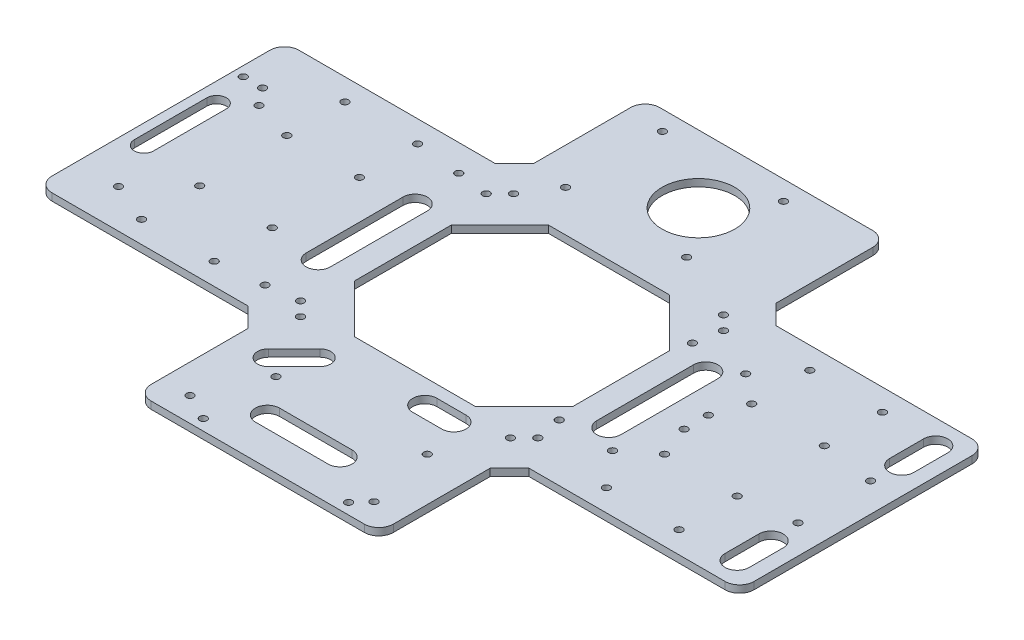
from build123d import *

# Parameters (mm, degrees)
EXTRUDE_1_DEPTH      = 3
SKETCH_2_R           = 1.5
CUT_EXTRUDE_1_DEPTH  = 3
SKETCH_3_R           = 15
SKETCH_3_R_2         = 1.5
CUT_EXTRUDE_2_DEPTH  = 10
SKETCH_4_W           = 90
SKETCH_4_H           = 80
CUT_EXTRUDE_3_DEPTH  = 3
FILLET_3_R           = 6
CHAMFER_1_SIZE       = 8
SKETCH_7_R           = 1.5
CUT_EXTRUDE_6_DEPTH  = 10
CHAMFER_2_SIZE       = 20
SKETCH_8_R           = 1.5
CUT_EXTRUDE_7_DEPTH  = 10
SKETCH_9_R           = 1.5
CUT_EXTRUDE_8_DEPTH  = 10
SKETCH_10_R          = 1.5
CUT_EXTRUDE_9_DEPTH  = 10
CUT_EXTRUDE_10_DEPTH = 10


with BuildPart() as part:
    # 草图1 → 凸台-拉伸1 (new body)
    with BuildSketch(Plane(origin=(0, 0, 0), x_dir=(1, 0, 0), z_dir=(0, 1, 0))):
        Polygon((-50, -51), (-50, -105), (50, -105), (50, -51), (145, -51), (145, 51), (50, 51), (50, 105), (-50, 105), (-50, 51), (-145, 51), (-145, -51), align=None)
    extrude(amount=EXTRUDE_1_DEPTH)

    # 草图2 → 切除-拉伸1 (cut)
    with BuildSketch(Plane(origin=(0, 3, 0), x_dir=(1, 0, 0), z_dir=(0, 1, 0))):
        with Locations(Location((111, 42, 0), (0, 0, 270))):
            Circle(SKETCH_2_R)
        with Locations(Location((81, 42, 0), (0, 0, 270))):
            Circle(SKETCH_2_R)
        with Locations(Location((81, 18, 0), (0, 0, 270))):
            Circle(SKETCH_2_R)
        with Locations(Location((111, 18, 0), (0, 0, 270))):
            Circle(SKETCH_2_R)
        with Locations(Location((111, -18, 0), (0, 0, 90))):
            Circle(SKETCH_2_R)
        with Locations(Location((111, -42, 0), (0, 0, 90))):
            Circle(SKETCH_2_R)
        with Locations(Location((81, -18, 0), (0, 0, 90))):
            Circle(SKETCH_2_R)
        with Locations(Location((81, -42, 0), (0, 0, 90))):
            Circle(SKETCH_2_R)
        with Locations(Location((-81, -42, 0), (0, 0, 270))):
            Circle(SKETCH_2_R)
        with Locations(Location((-81, -18, 0), (0, 0, 270))):
            Circle(SKETCH_2_R)
        with Locations(Location((-111, -42, 0), (0, 0, 270))):
            Circle(SKETCH_2_R)
        with Locations(Location((-111, -18, 0), (0, 0, 270))):
            Circle(SKETCH_2_R)
        with Locations(Location((-111, 18, 0), (0, 0, 90))):
            Circle(SKETCH_2_R)
        with Locations(Location((-81, 18, 0), (0, 0, 90))):
            Circle(SKETCH_2_R)
        with Locations(Location((-81, 42, 0), (0, 0, 90))):
            Circle(SKETCH_2_R)
        with Locations(Location((-111, 42, 0), (0, 0, 90))):
            Circle(SKETCH_2_R)
    extrude(amount=-CUT_EXTRUDE_1_DEPTH, mode=Mode.SUBTRACT)

    # 草图3 → 切除-拉伸2 (cut)
    with BuildSketch(Plane(origin=(0, 3, 0), x_dir=(1, 0, 0), z_dir=(0, 1, 0))):
        with Locations(Location((0, 77, 0), (0, 0, 270))):
            Circle(SKETCH_3_R)
        with Locations(Location((15.11, 97, 0), (0, 0, 270))):
            Circle(SKETCH_3_R_2)
        with Locations(Location((15.11, 57, 0), (0, 0, 270))):
            Circle(SKETCH_3_R_2)
        with Locations(Location((-34.89, 57, 0), (0, 0, 270))):
            Circle(SKETCH_3_R_2)
        with Locations(Location((-34.89, 97, 0), (0, 0, 270))):
            Circle(SKETCH_3_R_2)
        with Locations(Location((-27, -70.5, 0), (0, 0, 270))):
            Circle(SKETCH_3_R_2)
        with Locations(Location((32, -67, 0), (0, 0, 270))):
            Circle(SKETCH_3_R_2)
        with Locations(Location((-27, -100.5, 0), (0, 0, 270))):
            Circle(SKETCH_3_R_2)
        with Locations(Location((33, -100.5, 0), (0, 0, 270))):
            Circle(SKETCH_3_R_2)
    extrude(amount=-CUT_EXTRUDE_2_DEPTH, mode=Mode.SUBTRACT)

    # 草图4 → 切除-拉伸3 (cut)
    with BuildSketch(Plane(origin=(0, 3, 0), x_dir=(1, 0, 0), z_dir=(0, 1, 0))):
        Rectangle(SKETCH_4_W, SKETCH_4_H)
    extrude(amount=-CUT_EXTRUDE_3_DEPTH, mode=Mode.SUBTRACT)

    # 圆角3
    fillet_3_edges = [part.edges().sort_by_distance(p)[0] for p in [
        (-145, 1.5, 51),
        (-145, 1.5, -51),
        (-50, 1.5, -105),
        (50, 1.5, -105),
        (145, 1.5, -51),
        (145, 1.5, 51),
        (50, 1.5, 105),
        (-50, 1.5, 105),
    ]]
    fillet(fillet_3_edges, radius=FILLET_3_R)

    # 倒角1
    chamfer_1_edges = [part.edges().sort_by_distance(p)[0] for p in [
        (-50, 1.5, 51),
        (-50, 1.5, -51),
        (50, 1.5, -51),
        (50, 1.5, 51),
    ]]
    chamfer(chamfer_1_edges, length=CHAMFER_1_SIZE)

    # 草图7 → 切除-拉伸6 (cut)
    with BuildSketch(Plane(origin=(0, 3, 0), x_dir=(1, 0, 0), z_dir=(0, 1, 0))):
        with Locations(Location((47, 27.5, 0), (0, 0, 270))):
            Circle(SKETCH_7_R)
        with Locations(Location((47, -27.5, 0), (0, 0, 270))):
            Circle(SKETCH_7_R)
        with Locations(Location((69, 27.5, 0), (0, 0, 270))):
            Circle(SKETCH_7_R)
        with Locations(Location((69, -27.5, 0), (0, 0, 270))):
            Circle(SKETCH_7_R)
        with BuildLine():
            Line((-65, -20), (-65, 20))
            ThreePointArc((-65, 20), (-60, 25), (-55, 20))
            Line((-55, 20), (-55, -20))
            ThreePointArc((-55, -20), (-60, -25), (-65, -20))
        make_face()
        with BuildLine():
            Line((65, -20), (65, 20))
            ThreePointArc((65, 20), (60, 25), (55, 20))
            Line((55, 20), (55, -20))
            ThreePointArc((55, -20), (60, -25), (65, -20))
        make_face()
        with BuildLine():
            Line((-141, -15), (-141, 15))
            ThreePointArc((-141, 15), (-137, 19), (-133, 15))
            Line((-133, 15), (-133, -15))
            ThreePointArc((-133, -15), (-137, -19), (-141, -15))
        make_face()
        with BuildLine():
            Line((129, 27), (129, 41))
            ThreePointArc((129, 41), (134, 46), (139, 41))
            Line((139, 41), (139, 27))
            ThreePointArc((139, 27), (134, 22), (129, 27))
        make_face()
        with BuildLine():
            Line((129, -27), (129, -41))
            ThreePointArc((129, -41), (134, -46), (139, -41))
            Line((139, -41), (139, -27))
            ThreePointArc((139, -27), (134, -22), (129, -27))
        make_face()
    extrude(amount=-CUT_EXTRUDE_6_DEPTH, mode=Mode.SUBTRACT)

    # 倒角2
    chamfer_2_edges = [part.edges().sort_by_distance(p)[0] for p in [
        (45, 1.5, -40),
        (45, 1.5, 40),
        (-45, 1.5, 40),
        (-45, 1.5, -40),
    ]]
    chamfer(chamfer_2_edges, length=CHAMFER_2_SIZE)

    # 草图8 → 切除-拉伸7 (cut)
    with BuildSketch(Plane(origin=(0, 3, 0), x_dir=(1, 0, 0), z_dir=(0, 1, 0))):
        with Locations(Location((-127.5, 23, 0), (0, 0, 270))):
            Circle(SKETCH_8_R)
        with Locations(Location((-127.5, -35, 0), (0, 0, 270))):
            Circle(SKETCH_8_R)
        with Locations(Location((-141, 30, 0), (0, 0, 270))):
            Circle(SKETCH_8_R)
        with Locations(Location((-133, 30, 0), (0, 0, 270))):
            Circle(SKETCH_8_R)
    extrude(amount=-CUT_EXTRUDE_7_DEPTH, mode=Mode.SUBTRACT)

    # 草图9 → 切除-拉伸8 (cut)
    with BuildSketch(Plane(origin=(0, 3, 0), x_dir=(1, 0, 0), z_dir=(0, 1, 0))):
        with Locations(Location((43.343145751, 44, 0), (0, 0, 270))):
            Circle(SKETCH_9_R)
        with Locations(Location((49, 38.343145751, 0), (0, 0, 270))):
            Circle(SKETCH_9_R)
        with Locations(Location((49, -38.343145751, 0), (0, 0, 270))):
            Circle(SKETCH_9_R)
        with Locations(Location((43.343145751, -44, 0), (0, 0, 270))):
            Circle(SKETCH_9_R)
        with Locations(Location((-43.343145751, -44, 0), (0, 0, 270))):
            Circle(SKETCH_9_R)
        with Locations(Location((-49, -38.343145751, 0), (0, 0, 270))):
            Circle(SKETCH_9_R)
        with Locations(Location((-49, 38.343145751, 0), (0, 0, 270))):
            Circle(SKETCH_9_R)
        with Locations(Location((-43.343145751, 44, 0), (0, 0, 270))):
            Circle(SKETCH_9_R)
        with Locations(Location((-38, -95, 0), (0, 0, 270))):
            Circle(SKETCH_9_R)
        with Locations(Location((38, -95, 0), (0, 0, 270))):
            Circle(SKETCH_9_R)
        with Locations(Location((-62, 40, 0), (0, 0, 270))):
            Circle(SKETCH_9_R)
        with Locations(Location((-62, -40, 0), (0, 0, 270))):
            Circle(SKETCH_9_R)
    extrude(amount=-CUT_EXTRUDE_8_DEPTH, mode=Mode.SUBTRACT)

    # 草图10 → 切除-拉伸9 (cut)
    with BuildSketch(Plane(origin=(0, 3, 0), x_dir=(1, 0, 0), z_dir=(0, 1, 0))):
        with Locations(Location((76.1, 5, 0), (0, 0, 270))):
            Circle(SKETCH_10_R)
        with Locations(Location((133.1, 15, 0), (0, 0, 270))):
            Circle(SKETCH_10_R)
        with Locations(Location((133.1, -15, 0), (0, 0, 270))):
            Circle(SKETCH_10_R)
        with Locations(Location((76.1, -5, 0), (0, 0, 270))):
            Circle(SKETCH_10_R)
    extrude(amount=-CUT_EXTRUDE_9_DEPTH, mode=Mode.SUBTRACT)

    # 草图11 → 切除-拉伸10 (cut)
    with BuildSketch(Plane(origin=(0, 3, 0), x_dir=(1, 0, 0), z_dir=(0, 1, 0))):
        with BuildLine():
            Line((-21.514718626, -57.878679656), (-32.121320344, -68.485281374))
            ThreePointArc((-32.121320344, -68.485281374), (-38.485281374, -68.485281374), (-38.485281374, -62.121320344))
            Line((-38.485281374, -62.121320344), (-27.878679656, -51.514718626))
            ThreePointArc((-27.878679656, -51.514718626), (-21.514718626, -51.514718626), (-21.514718626, -57.878679656))
        make_face()
        with BuildLine():
            Line((14, -45), (26, -45))
            ThreePointArc((26, -45), (31, -50), (26, -55))
            Line((26, -55), (14, -55))
            ThreePointArc((14, -55), (9, -50), (14, -45))
        make_face()
        with BuildLine():
            Line((-15, -81), (15, -81))
            ThreePointArc((15, -81), (20, -86), (15, -91))
            Line((15, -91), (-15, -91))
            ThreePointArc((-15, -91), (-20, -86), (-15, -81))
        make_face()
    extrude(amount=-CUT_EXTRUDE_10_DEPTH, mode=Mode.SUBTRACT)


solid = part.part
